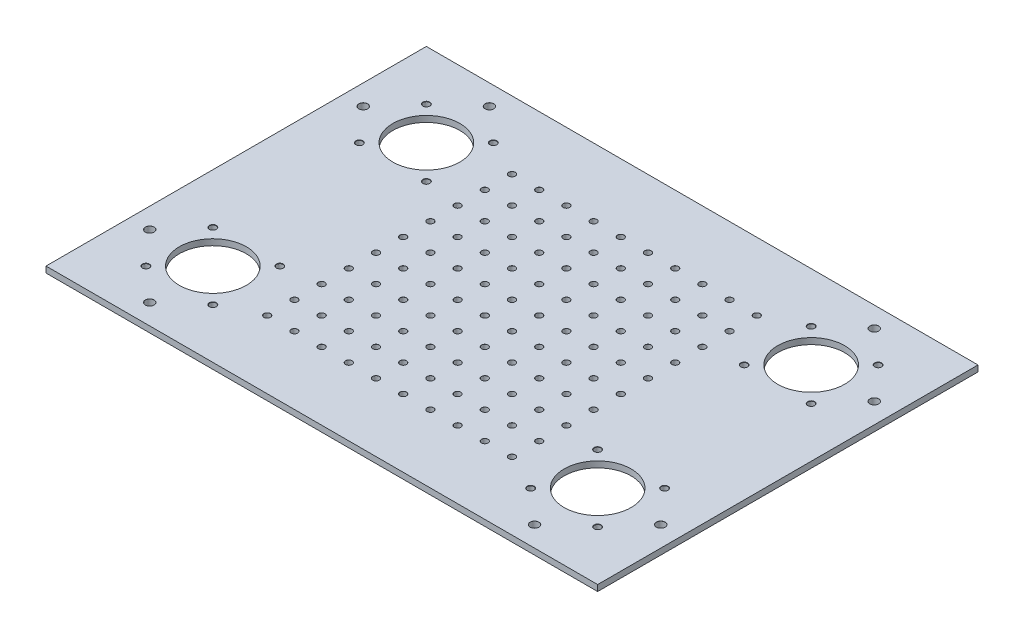
from build123d import *

# Parameters (mm, degrees)
SKETCH1_W                            = 271.8
SKETCH1_H                            = 187.4
SKETCH1_R                            = 16.5
BOSS_EXTRUDE1_DEPTH                  = 3
M3_CLEARANCE_HOLE1_D                 = 3.2
M3_CLEARANCE_HOLE1_CSINK_D           = 3.45
M3_CLEARANCE_HOLE1_CSINK_ANGLE       = 90
M4_CLEARANCE_HOLE2_D                 = 4.3
M4_CLEARANCE_HOLE2_CSINK_D           = 4.35
M4_CLEARANCE_HOLE2_CSINK_ANGLE       = 90
F_3_2_3_2_DIAMETER_HOLE1_D           = 3.2
F_3_2_3_2_DIAMETER_HOLE1_CSINK_D     = 3.25
F_3_2_3_2_DIAMETER_HOLE1_CSINK_ANGLE = 90


with BuildPart() as part:
    # Sketch1 → Boss-Extrude1 (new body)
    with BuildSketch(Plane(origin=(0, 0, 0), x_dir=(1, 0, 0), z_dir=(0, 1, 0))):
        Rectangle(SKETCH1_W, SKETCH1_H)
        with Locations(Location((-94.8, 52.6, 0), (0, 0, 270))):
            Circle(SKETCH1_R, mode=Mode.SUBTRACT)
        with Locations(Location((-94.8, -52.6, 0), (0, 0, 270))):
            Circle(SKETCH1_R, mode=Mode.SUBTRACT)
        with Locations(Location((94.8, -52.6, 0), (0, 0, 270))):
            Circle(SKETCH1_R, mode=Mode.SUBTRACT)
        with Locations(Location((94.8, 52.6, 0), (0, 0, 270))):
            Circle(SKETCH1_R, mode=Mode.SUBTRACT)
    extrude(amount=BOSS_EXTRUDE1_DEPTH)

    # M3 Clearance Hole1 (through all)
    with Locations(Plane(origin=(0, 3, 0), x_dir=(1, 0, 0), z_dir=(0, 1, 0))):
        with Locations((-78.3, 36.1), (-111.3, 69.1), (-111.3, 36.1), (-78.3, 69.1), (-78.3, -69.1), (-111.3, -36.1), (-111.3, -69.1), (-78.3, -36.1), (78.3, -36.1), (111.3, -69.1), (111.3, -36.1), (78.3, -69.1), (78.3, 69.1), (111.3, 36.1), (111.3, 69.1), (78.3, 36.1)):
            CounterSinkHole(M3_CLEARANCE_HOLE1_D / 2, M3_CLEARANCE_HOLE1_CSINK_D / 2, counter_sink_angle=M3_CLEARANCE_HOLE1_CSINK_ANGLE)

    # M4 Clearance Hole2 (through all)
    with Locations(Plane(origin=(0, 3, 0), x_dir=(1, 0, 0), z_dir=(0, 1, 0))):
        with Locations((-94.8, 83.7), (-125.9, 52.6), (-125.9, -52.6), (-94.8, -83.7), (94.8, -83.7), (125.9, -52.6), (125.9, 52.6), (94.8, 83.7)):
            CounterSinkHole(M4_CLEARANCE_HOLE2_D / 2, M4_CLEARANCE_HOLE2_CSINK_D / 2, counter_sink_angle=M4_CLEARANCE_HOLE2_CSINK_ANGLE)

    # Ø3.2 (3.2) Diameter Hole1 (through all)
    with Locations(Plane(origin=(0, 3, 0), x_dir=(1, 0, 0), z_dir=(0, 1, 0))):
        with Locations((-60.3, 60.3), (-46.9, 60.3), (-33.5, 60.3), (-20.1, 60.3), (-6.7, 60.3), (6.7, 60.3), (20.1, 60.3), (33.5, 60.3), (46.9, 60.3), (60.3, 60.3), (-46.9, 46.9), (-33.5, 46.9), (-20.1, 46.9), (-6.7, 46.9), (6.7, 46.9), (20.1, 46.9), (33.5, 46.9), (46.9, 46.9), (60.3, 46.9), (-46.9, 33.5), (-33.5, 33.5), (-20.1, 33.5), (-6.7, 33.5), (6.7, 33.5), (20.1, 33.5), (33.5, 33.5), (46.9, 33.5), (60.3, 33.5), (-46.9, 20.1), (-33.5, 20.1), (-20.1, 20.1), (-6.7, 20.1), (6.7, 20.1), (20.1, 20.1), (33.5, 20.1), (46.9, 20.1), (60.3, 20.1), (-46.9, 6.7), (-33.5, 6.7), (-20.1, 6.7), (-6.7, 6.7), (6.7, 6.7), (20.1, 6.7), (33.5, 6.7), (46.9, 6.7), (60.3, 6.7), (-46.9, -6.7), (-33.5, -6.7), (-20.1, -6.7), (-6.7, -6.7), (6.7, -6.7), (20.1, -6.7), (33.5, -6.7), (46.9, -6.7), (60.3, -6.7), (-46.9, -20.1), (-33.5, -20.1), (-20.1, -20.1), (-6.7, -20.1), (6.7, -20.1), (20.1, -20.1), (33.5, -20.1), (46.9, -20.1), (60.3, -20.1), (-46.9, -33.5), (-33.5, -33.5), (-20.1, -33.5), (-6.7, -33.5), (6.7, -33.5), (20.1, -33.5), (33.5, -33.5), (46.9, -33.5), (60.3, -33.5), (-46.9, -46.9), (-33.5, -46.9), (-20.1, -46.9), (-6.7, -46.9), (6.7, -46.9), (20.1, -46.9), (33.5, -46.9), (46.9, -46.9), (60.3, -46.9), (-46.9, -60.3), (-33.5, -60.3), (-20.1, -60.3), (-6.7, -60.3), (6.7, -60.3), (20.1, -60.3), (33.5, -60.3), (46.9, -60.3), (60.3, -60.3), (-60.3, 46.9), (-60.3, 33.5), (-60.3, 20.1), (-60.3, 6.7), (-60.3, -6.7), (-60.3, -20.1), (-60.3, -33.5), (-60.3, -46.9), (-60.3, -60.3)):
            CounterSinkHole(F_3_2_3_2_DIAMETER_HOLE1_D / 2, F_3_2_3_2_DIAMETER_HOLE1_CSINK_D / 2, counter_sink_angle=F_3_2_3_2_DIAMETER_HOLE1_CSINK_ANGLE)


solid = part.part
